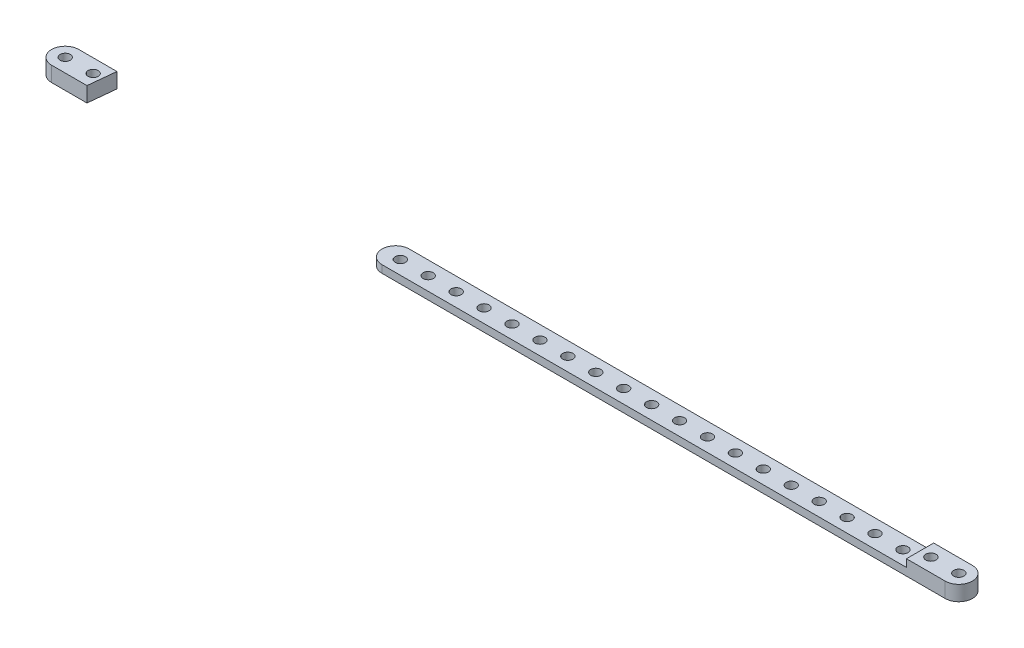
from build123d import *

# Parameters (mm, degrees)
SKETCH1_R           = 2.1336
BOSS_EXTRUDE1_DEPTH = 6.35
CUT_EXTRUDE1_DEPTH  = 194.660324073
SKETCH3_W           = 305.852085709
SKETCH3_H           = 112.922210452
CUT_EXTRUDE2_DEPTH  = 3.175
CUT_EXTRUDE3_DEPTH  = 194.58222864


with BuildPart() as part:
    # Sketch1 → Boss-Extrude1 (new body)
    with BuildSketch(Plane(origin=(0, 6.35, 0), x_dir=(1, 0, 0), z_dir=(0, 1, 0))):
        with BuildLine():
            Line((187.7568, 5.715), (-187.7568, 5.715))
            ThreePointArc((-187.7568, 5.715), (-193.4718, 0), (-187.7568, -5.715))
            Line((-187.7568, -5.715), (187.7568, -5.715))
            ThreePointArc((187.7568, -5.715), (193.4718, 0), (187.7568, 5.715))
        make_face()
        with Locations(Location((187.7568, 0, 0), (0, 0, 270))):
            Circle(SKETCH1_R, mode=Mode.SUBTRACT)
        with Locations(Location((176.022, 0, 0), (0, 0, 270))):
            Circle(SKETCH1_R, mode=Mode.SUBTRACT)
        with Locations(Location((164.2872, 0, 0), (0, 0, 270))):
            Circle(SKETCH1_R, mode=Mode.SUBTRACT)
        with Locations(Location((152.5524, 0, 0), (0, 0, 270))):
            Circle(SKETCH1_R, mode=Mode.SUBTRACT)
        with Locations(Location((140.8176, 0, 0), (0, 0, 270))):
            Circle(SKETCH1_R, mode=Mode.SUBTRACT)
        with Locations(Location((129.0828, 0, 0), (0, 0, 270))):
            Circle(SKETCH1_R, mode=Mode.SUBTRACT)
        with Locations(Location((117.348, 0, 0), (0, 0, 270))):
            Circle(SKETCH1_R, mode=Mode.SUBTRACT)
        with Locations(Location((105.6132, 0, 0), (0, 0, 270))):
            Circle(SKETCH1_R, mode=Mode.SUBTRACT)
        with Locations(Location((93.8784, 0, 0), (0, 0, 270))):
            Circle(SKETCH1_R, mode=Mode.SUBTRACT)
        with Locations(Location((82.1436, 0, 0), (0, 0, 270))):
            Circle(SKETCH1_R, mode=Mode.SUBTRACT)
        with Locations(Location((70.4088, 0, 0), (0, 0, 270))):
            Circle(SKETCH1_R, mode=Mode.SUBTRACT)
        with Locations(Location((58.674, 0, 0), (0, 0, 270))):
            Circle(SKETCH1_R, mode=Mode.SUBTRACT)
        with Locations(Location((46.9392, 0, 0), (0, 0, 270))):
            Circle(SKETCH1_R, mode=Mode.SUBTRACT)
        with Locations(Location((35.2044, 0, 0), (0, 0, 270))):
            Circle(SKETCH1_R, mode=Mode.SUBTRACT)
        with Locations(Location((23.4696, 0, 0), (0, 0, 270))):
            Circle(SKETCH1_R, mode=Mode.SUBTRACT)
        with Locations(Location((11.7348, 0, 0), (0, 0, 270))):
            Circle(SKETCH1_R, mode=Mode.SUBTRACT)
        with Locations(Location((0, 0, 0), (0, 0, 270))):
            Circle(SKETCH1_R, mode=Mode.SUBTRACT)
        with Locations(Location((-11.7348, 0, 0), (0, 0, 270))):
            Circle(SKETCH1_R, mode=Mode.SUBTRACT)
        with Locations(Location((-23.4696, 0, 0), (0, 0, 270))):
            Circle(SKETCH1_R, mode=Mode.SUBTRACT)
        with Locations(Location((-35.2044, 0, 0), (0, 0, 270))):
            Circle(SKETCH1_R, mode=Mode.SUBTRACT)
        with Locations(Location((-46.9392, 0, 0), (0, 0, 270))):
            Circle(SKETCH1_R, mode=Mode.SUBTRACT)
        with Locations(Location((-58.674, 0, 0), (0, 0, 270))):
            Circle(SKETCH1_R, mode=Mode.SUBTRACT)
        with Locations(Location((-70.4088, 0, 0), (0, 0, 270))):
            Circle(SKETCH1_R, mode=Mode.SUBTRACT)
        with Locations(Location((-82.1436, 0, 0), (0, 0, 270))):
            Circle(SKETCH1_R, mode=Mode.SUBTRACT)
        with Locations(Location((-93.8784, 0, 0), (0, 0, 270))):
            Circle(SKETCH1_R, mode=Mode.SUBTRACT)
        with Locations(Location((-105.6132, 0, 0), (0, 0, 270))):
            Circle(SKETCH1_R, mode=Mode.SUBTRACT)
        with Locations(Location((-117.348, 0, 0), (0, 0, 270))):
            Circle(SKETCH1_R, mode=Mode.SUBTRACT)
        with Locations(Location((-129.0828, 0, 0), (0, 0, 270))):
            Circle(SKETCH1_R, mode=Mode.SUBTRACT)
        with Locations(Location((-140.8176, 0, 0), (0, 0, 270))):
            Circle(SKETCH1_R, mode=Mode.SUBTRACT)
        with Locations(Location((-152.5524, 0, 0), (0, 0, 270))):
            Circle(SKETCH1_R, mode=Mode.SUBTRACT)
        with Locations(Location((-164.2872, 0, 0), (0, 0, 270))):
            Circle(SKETCH1_R, mode=Mode.SUBTRACT)
        with Locations(Location((-176.022, 0, 0), (0, 0, 270))):
            Circle(SKETCH1_R, mode=Mode.SUBTRACT)
        with Locations(Location((-187.7568, 0, 0), (0, 0, 270))):
            Circle(SKETCH1_R, mode=Mode.SUBTRACT)
    extrude(amount=-BOSS_EXTRUDE1_DEPTH)

    # Sketch2 → Cut-Extrude1 (cut, through all)
    with BuildSketch(Plane(origin=(0, 6.35, 0), x_dir=(1, 0, 0), z_dir=(0, 1, 0))):
        with BuildLine():
            Line((-117.348, -5.715), (-172.989647153, -6.593313788))
            Line((-172.989647153, -6.593313788), (-171.150394327, 11.273713671))
            Line((-171.150394327, 11.273713671), (-117.348, 5.715))
            ThreePointArc((-117.348, 5.715), (-123.063, 0), (-117.348, -5.715))
        make_face()
    extrude(amount=-CUT_EXTRUDE1_DEPTH, mode=Mode.SUBTRACT)


with BuildPart() as cut_extrude1_piece_1:
    # of the separate pieces the step leaves, piece 1, a body of its own (cut_extrude1_pieces)
    add(part.part.solids().sort_by_distance((187.7568, 6.35, -5.715))[0])

    # Sketch3 → Cut-Extrude2 (cut)
    with BuildSketch(Plane(origin=(0, 6.35, 0), x_dir=(1, 0, 0), z_dir=(0, 1, 0))):
        with Locations((18.54524475, 1.139349657)):
            Rectangle(SKETCH3_W, SKETCH3_H)
    extrude(amount=-CUT_EXTRUDE2_DEPTH, mode=Mode.SUBTRACT)

    # Sketch5 → Cut-Extrude3 (cut, through all)
    with BuildSketch(Plane(origin=(0, 3.175, 0), x_dir=(1, 0, 0), z_dir=(0, 1, 0))):
        with BuildLine():
            Line((-48.895, -5.715), (-130.836154728, -54.309000318))
            Line((-130.836154728, -54.309000318), (-122.987301535, 82.919336151))
            Line((-122.987301535, 82.919336151), (-48.895, 5.715))
            ThreePointArc((-48.895, 5.715), (-54.61, 0), (-48.895, -5.715))
        make_face()
    extrude(amount=-CUT_EXTRUDE3_DEPTH, mode=Mode.SUBTRACT)


with BuildPart() as cut_extrude1_piece_2:
    # of the separate pieces the step leaves, piece 2, a body of its own (cut_extrude1_pieces)
    add(part.part.solids().sort_by_distance((-187.7568, 6.35, -5.715))[0])


solid = Compound([cut_extrude1_piece_1.part, cut_extrude1_piece_2.part])
